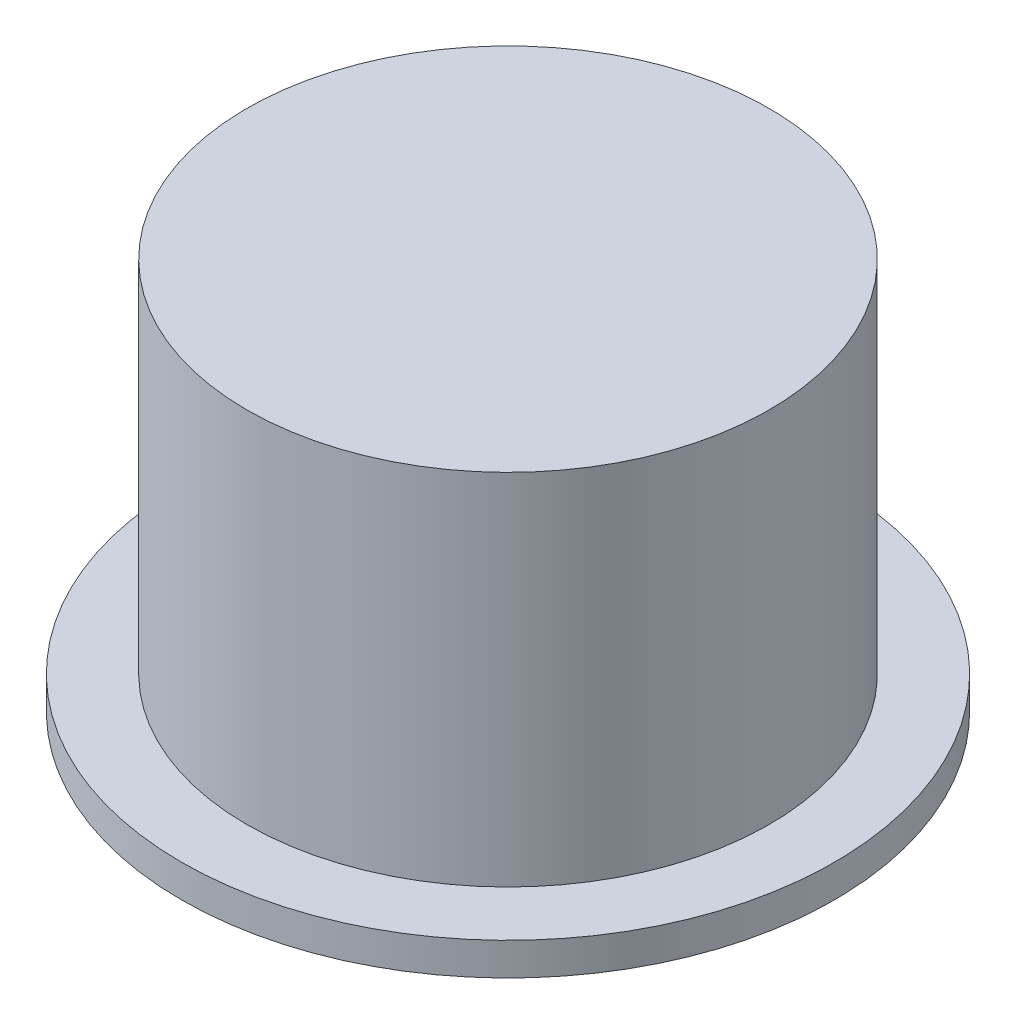
from build123d import *

# Parameters (mm, degrees)
SKETCH1_R           = 5
SKETCH1_R_2         = 4
BOSS_EXTRUDE1_DEPTH = 0.5
SKETCH1_3_R         = 4
BOSS_EXTRUDE2_DEPTH = 6


with BuildPart() as part:
    # Sketch1 → Boss-Extrude1 (new body)
    with BuildSketch(Plane(origin=(0, 0, 0), x_dir=(1, 0, 0), z_dir=(0, 1, 0))):
        Circle(SKETCH1_R)
        Circle(SKETCH1_R_2, mode=Mode.SUBTRACT)
    extrude(amount=BOSS_EXTRUDE1_DEPTH)

    # Sketch1<3> → Boss-Extrude2 (add)
    with BuildSketch(Plane(origin=(0, 0, 0), x_dir=(1, 0, 0), z_dir=(0, 1, 0))):
        Circle(SKETCH1_3_R)
    extrude(amount=BOSS_EXTRUDE2_DEPTH)


solid = part.part
